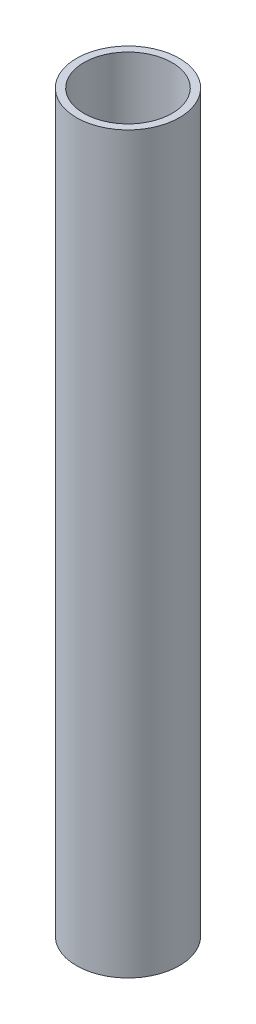
from build123d import *

# Parameters (mm, degrees)
SKETCH1_R           = 3.5
SKETCH1_R_2         = 3
BOSS_EXTRUDE1_DEPTH = 25


with BuildPart() as part:
    # Sketch1 → Boss-Extrude1 (new, symmetric)
    with BuildSketch(Plane(origin=(0, 0, 0), x_dir=(1, 0, 0), z_dir=(0, 1, 0))):
        with Locations(Location((0, 0, 0), (0, 0, 270))):
            Circle(SKETCH1_R)
        with Locations(Location((0, 0, 0), (0, 0, 270))):
            Circle(SKETCH1_R_2, mode=Mode.SUBTRACT)
    extrude(amount=BOSS_EXTRUDE1_DEPTH, both=True)


solid = part.part
